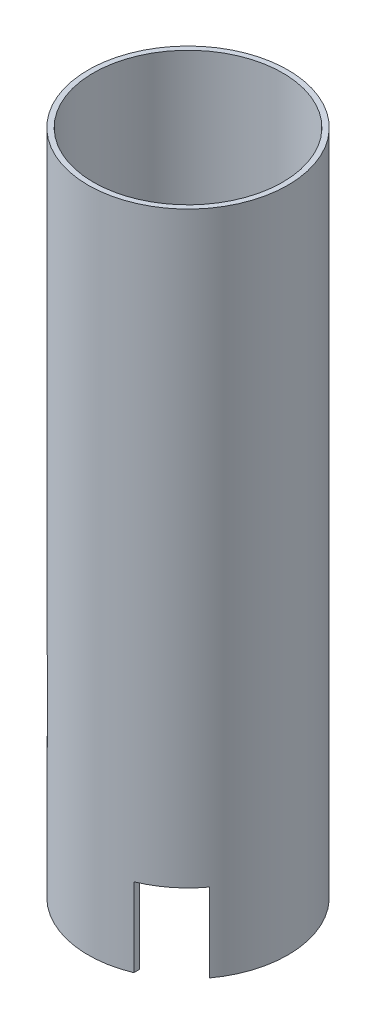
from build123d import *

# Parameters (mm, degrees)
SKETCH1_R           = 38.5
SKETCH1_R_2         = 36.5
BOSS_EXTRUDE1_DEPTH = 257
SKETCH3_W           = 21
SKETCH3_H           = 31
CUT_EXTRUDE1_DEPTH  = 50
SKETCH8_W           = 16.314187307
SKETCH8_H           = 32.341181037
CUT_EXTRUDE4_DEPTH  = 40


with BuildPart() as part:
    # Sketch1 → Boss-Extrude1 (new body)
    with BuildSketch(Plane(origin=(0, 0, 0), x_dir=(1, 0, 0), z_dir=(0, 1, 0))):
        with Locations(Location((0, 0, 0), (0, 0, 270))):
            Circle(SKETCH1_R)
        with Locations(Location((0, 0, 0), (0, 0, 270))):
            Circle(SKETCH1_R_2, mode=Mode.SUBTRACT)
    extrude(amount=BOSS_EXTRUDE1_DEPTH)

    # Sketch3 → Cut-Extrude1 (cut)
    with BuildSketch(Plane(origin=(0, 0, 0), x_dir=(0, 0, -1), z_dir=(1, 0, 0))):
        with Locations((-19.608340935, 67.295682387)):
            Rectangle(SKETCH3_W, SKETCH3_H)
    extrude(amount=-CUT_EXTRUDE1_DEPTH, mode=Mode.SUBTRACT)

    # Sketch8 → Cut-Extrude4 (cut)
    with BuildSketch(Plane.XY):
        with Locations((22.858818879, 14.180131948)):
            Rectangle(SKETCH8_W, SKETCH8_H)
    extrude(amount=CUT_EXTRUDE4_DEPTH, mode=Mode.SUBTRACT)


solid = part.part
